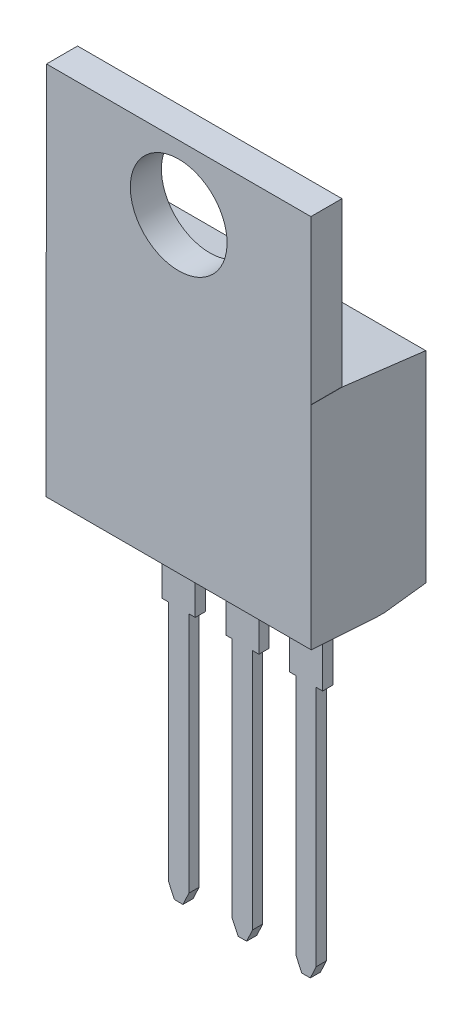
from build123d import *
from OCP.BRepFilletAPI import BRepFilletAPI_MakeChamfer

# Parameters (mm, degrees)
LINEAR_AUSTRAGEN1_DEPTH              = 5.2
F_3_8_3_8_DURCHMESSER_BOHRUNG1_D     = 3.8
F_3_8_3_8_DURCHMESSER_BOHRUNG1_DEPTH = 5
F_3_8_3_8_DURCHMESSER_BOHRUNG1_TIP   = 1.141635176
SKIZZE4_W                            = 1.3
SKIZZE4_H                            = 0.4
LINEAR_AUSTRAGEN2_DEPTH              = 3.5
SKIZZE5_W                            = 0.8
SKIZZE5_H                            = 0.4
LINEAR_AUSTRAGEN3_DEPTH              = 10
FASE1_SIZE                           = 0.5
FASE1_SIZE2                          = 0.233153829
SKIZZE7_W                            = 1.22
SKIZZE7_H                            = 6.4
SCHNITT_LINEAR_AUSTRAGEN1_DEPTH      = 0.01


with BuildPart() as part:
    # Skizze1 → Linear austragen1 (new, symmetric)
    with BuildSketch(Plane(origin=(0, 0, 0), x_dir=(0, 0, -1), z_dir=(1, 0, 0))):
        Polygon((0, 0), (1.22, 0), (1.22, -6.4), (4.499948007, -6.802726976), (4.499948007, -14.703551087), (2.9, -14.9), (2.5, -14.9), (0, -14.72518297), align=None)
    extrude(amount=LINEAR_AUSTRAGEN1_DEPTH, both=True)

    # Ø3.8 (3.8) Durchmesser Bohrung1
    with Locations(Plane(origin=(0, 0, -1.22), x_dir=(-1, 0, 0), z_dir=(0, 0, -1))):
        with Locations((0, -2.54)):
            Hole(F_3_8_3_8_DURCHMESSER_BOHRUNG1_D / 2, depth=F_3_8_3_8_DURCHMESSER_BOHRUNG1_DEPTH)
            with Locations((0, 0, -(F_3_8_3_8_DURCHMESSER_BOHRUNG1_DEPTH + F_3_8_3_8_DURCHMESSER_BOHRUNG1_TIP / 2))):  # 118° drill point
                Cone(0, F_3_8_3_8_DURCHMESSER_BOHRUNG1_D / 2, F_3_8_3_8_DURCHMESSER_BOHRUNG1_TIP, mode=Mode.SUBTRACT)

    # Skizze4 → Linear austragen2 (add)
    with BuildSketch(Plane.XZ.offset(14.9)):
        with Locations((-2.5, -2.7)):
            Rectangle(SKIZZE4_W, SKIZZE4_H)
        with Locations((0, -2.7)):
            Rectangle(SKIZZE4_W, SKIZZE4_H)
        with Locations((2.5, -2.7)):
            Rectangle(SKIZZE4_W, SKIZZE4_H)
    extrude(amount=LINEAR_AUSTRAGEN2_DEPTH)

    # Skizze5 → Linear austragen3 (add)
    with BuildSketch(Plane.XZ.offset(18.4)):
        with Locations((2.5, -2.7)):
            Rectangle(SKIZZE5_W, SKIZZE5_H)
        with Locations((0, -2.7)):
            Rectangle(SKIZZE5_W, SKIZZE5_H)
        with Locations((-2.5, -2.7)):
            Rectangle(SKIZZE5_W, SKIZZE5_H)
    extrude(amount=LINEAR_AUSTRAGEN3_DEPTH)

    # Fase1: one chamfer whose edges measure the first distance from different faces: ONE call of the kernel's chamfer builder (chamfer() names one face for all edges)
    fase1_edges_1 = [part.edges().sort_by_distance(p)[0] for p in [
        (-2.9, -28.4, -2.7),
    ]]
    fase1_side_1 = [part.faces().sort_by_distance(p)[0] for p in [
        (-2.9, -23.4, -2.7),
    ]]
    fase1_edges_2 = [part.edges().sort_by_distance(p)[0] for p in [
        (-2.1, -28.4, -2.7),
    ]]
    fase1_side_2 = [part.faces().sort_by_distance(p)[0] for p in [
        (-2.1, -23.4, -2.7),
    ]]
    fase1_edges_3 = [part.edges().sort_by_distance(p)[0] for p in [
        (0.4, -28.4, -2.7),
    ]]
    fase1_side_3 = [part.faces().sort_by_distance(p)[0] for p in [
        (0.4, -23.4, -2.7),
    ]]
    fase1_edges_4 = [part.edges().sort_by_distance(p)[0] for p in [
        (-0.4, -28.4, -2.7),
    ]]
    fase1_side_4 = [part.faces().sort_by_distance(p)[0] for p in [
        (-0.4, -23.4, -2.7),
    ]]
    fase1_edges_5 = [part.edges().sort_by_distance(p)[0] for p in [
        (2.1, -28.4, -2.7),
    ]]
    fase1_side_5 = [part.faces().sort_by_distance(p)[0] for p in [
        (2.1, -23.4, -2.7),
    ]]
    fase1_edges_6 = [part.edges().sort_by_distance(p)[0] for p in [
        (2.9, -28.4, -2.7),
    ]]
    fase1_side_6 = [part.faces().sort_by_distance(p)[0] for p in [
        (2.9, -23.4, -2.7),
    ]]
    fase1 = BRepFilletAPI_MakeChamfer(part.part.solid().wrapped)
    for e in fase1_edges_1:
        fase1.Add(FASE1_SIZE, FASE1_SIZE2, e.wrapped, fase1_side_1[0].wrapped)  # the first distance lies on this face
    for e in fase1_edges_2:
        fase1.Add(FASE1_SIZE, FASE1_SIZE2, e.wrapped, fase1_side_2[0].wrapped)  # the first distance lies on this face
    for e in fase1_edges_3:
        fase1.Add(FASE1_SIZE, FASE1_SIZE2, e.wrapped, fase1_side_3[0].wrapped)  # the first distance lies on this face
    for e in fase1_edges_4:
        fase1.Add(FASE1_SIZE, FASE1_SIZE2, e.wrapped, fase1_side_4[0].wrapped)  # the first distance lies on this face
    for e in fase1_edges_5:
        fase1.Add(FASE1_SIZE, FASE1_SIZE2, e.wrapped, fase1_side_5[0].wrapped)  # the first distance lies on this face
    for e in fase1_edges_6:
        fase1.Add(FASE1_SIZE, FASE1_SIZE2, e.wrapped, fase1_side_6[0].wrapped)  # the first distance lies on this face
    add(Compound.cast(fase1.Shape()), mode=Mode.REPLACE)

    # Skizze7 → Schnitt-Linear austragen1 (cut)
    with BuildSketch(Plane.ZY.offset(5.2)):
        with Locations((-0.61, -3.2)):
            Rectangle(SKIZZE7_W, SKIZZE7_H)
    schnitt_linear_austragen1 = extrude(amount=-SCHNITT_LINEAR_AUSTRAGEN1_DEPTH, mode=Mode.SUBTRACT)

    # Spiegeln1: Schnitt-Linear austragen1 across plane
    add(schnitt_linear_austragen1.mirror(Plane(origin=(0, 0, 0), x_dir=(0, 0, 1), z_dir=(1, 0, 0))), mode=Mode.SUBTRACT)


solid = part.part
